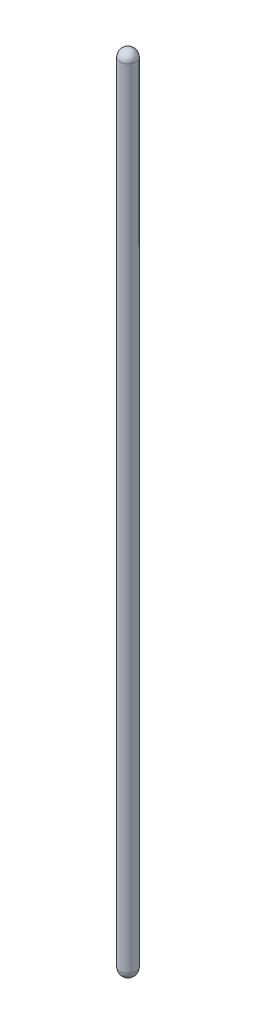
from build123d import *

# Parameters (mm, degrees)
SKETCH1_R           = 5
BOSS_EXTRUDE1_DEPTH = 500
FILLET1_R           = 5


with BuildPart() as part:
    # Sketch1 → Boss-Extrude1 (new body)
    with BuildSketch(Plane(origin=(0, 0, 0), x_dir=(1, 0, 0), z_dir=(0, 1, 0))):
        Circle(SKETCH1_R)
    extrude(amount=BOSS_EXTRUDE1_DEPTH)

    # Fillet1
    fillet1_edges = [part.edges().sort_by_distance(p)[0] for p in [
        (-5, 500, 0),
        (-5, 0, 0),
    ]]
    fillet(fillet1_edges, radius=FILLET1_R)


solid = part.part
